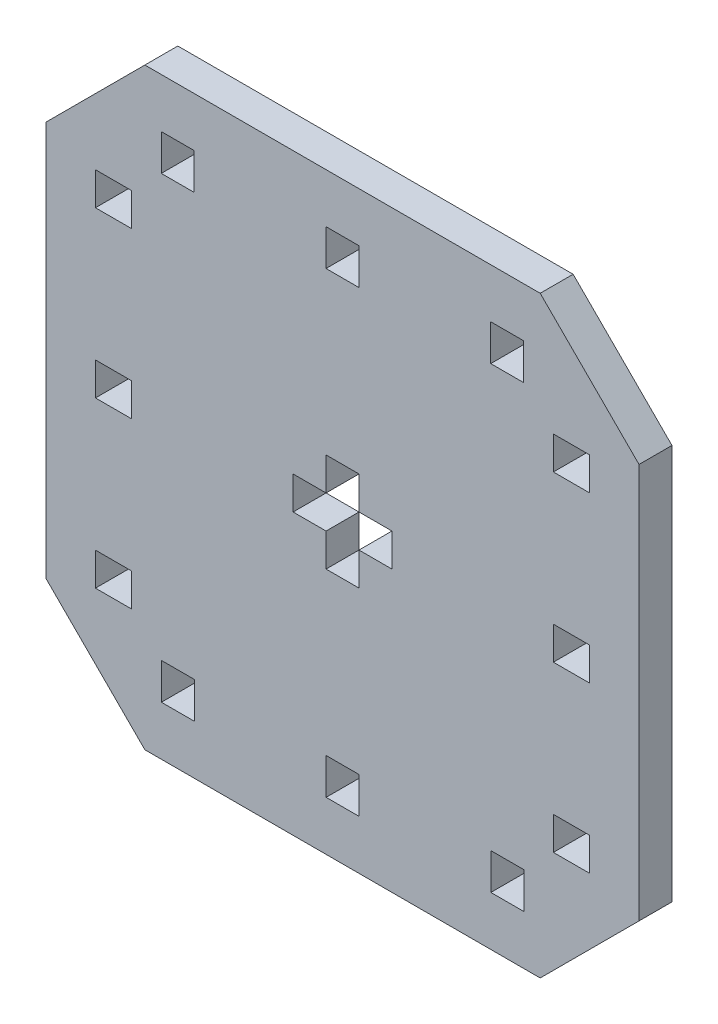
from build123d import *

# Parameters (mm, degrees)
SKETCH1_W           = 3.3
SKETCH1_H           = 3
SKETCH1_W_2         = 3
SKETCH1_H_2         = 3.3
BOSS_EXTRUDE1_DEPTH = 3


with BuildPart() as part:
    # Sketch1 → Boss-Extrude1 (new body)
    with BuildSketch(Plane.XY):
        Polygon((165, 252), (156, 243), (120, 243), (111, 252), (111, 288), (120, 297), (156, 297), (165, 288), align=None)
        with Locations((117.15, 254.994383568)):
            Rectangle(SKETCH1_W, SKETCH1_H, mode=Mode.SUBTRACT)
        Polygon((136.5, 274.5), (136.5, 271.5), (133.5, 271.5), (133.5, 268.5), (136.5, 268.5), (136.5, 265.5), (139.5, 265.5), (139.5, 268.5), (142.5, 268.5), (142.5, 271.5), (139.5, 271.5), (139.5, 274.5), align=None, mode=Mode.SUBTRACT)
        with Locations((117.15, 284.994383568)):
            Rectangle(SKETCH1_W, SKETCH1_H, mode=Mode.SUBTRACT)
        with Locations((117.15, 269.994383568)):
            Rectangle(SKETCH1_W, SKETCH1_H, mode=Mode.SUBTRACT)
        with Locations((123.005616432, 249.15)):
            Rectangle(SKETCH1_W_2, SKETCH1_H_2, mode=Mode.SUBTRACT)
        with Locations((158.85, 255.005616432)):
            Rectangle(SKETCH1_W, SKETCH1_H, mode=Mode.SUBTRACT)
        with Locations((152.994383568, 290.85)):
            Rectangle(SKETCH1_W_2, SKETCH1_H_2, mode=Mode.SUBTRACT)
        with Locations((138.005616432, 249.15)):
            Rectangle(SKETCH1_W_2, SKETCH1_H_2, mode=Mode.SUBTRACT)
        with Locations((153.005616432, 249.15)):
            Rectangle(SKETCH1_W_2, SKETCH1_H_2, mode=Mode.SUBTRACT)
        with Locations((158.85, 270.005616432)):
            Rectangle(SKETCH1_W, SKETCH1_H, mode=Mode.SUBTRACT)
        with Locations((158.85, 285.005616432)):
            Rectangle(SKETCH1_W, SKETCH1_H, mode=Mode.SUBTRACT)
        with Locations((137.994383568, 290.85)):
            Rectangle(SKETCH1_W_2, SKETCH1_H_2, mode=Mode.SUBTRACT)
        with Locations((122.994383568, 290.85)):
            Rectangle(SKETCH1_W_2, SKETCH1_H_2, mode=Mode.SUBTRACT)
    extrude(amount=BOSS_EXTRUDE1_DEPTH)


solid = part.part
